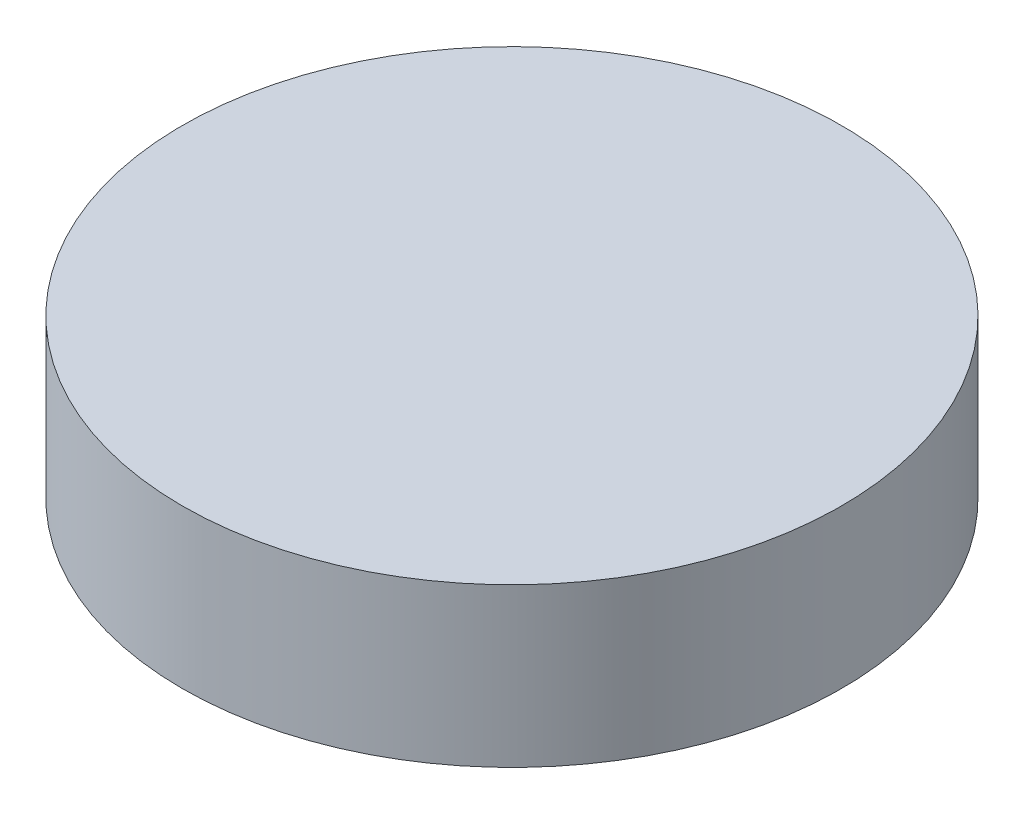
from build123d import *

# Parameters (mm, degrees)
SKETCH1_R                  = 25
TOPPING_AYAR_AYAGI_3_DEPTH = 12


with BuildPart() as part:
    # Sketch1 → TOPPING_ayar_ayagi_3 (new body)
    with BuildSketch(Plane(origin=(0, 0, 0), x_dir=(1, 0, 0), z_dir=(0, 1, 0))):
        with Locations(Location((50, 770, 0), (0, 0, 270))):
            Circle(SKETCH1_R)
    extrude(amount=TOPPING_AYAR_AYAGI_3_DEPTH)


solid = part.part
